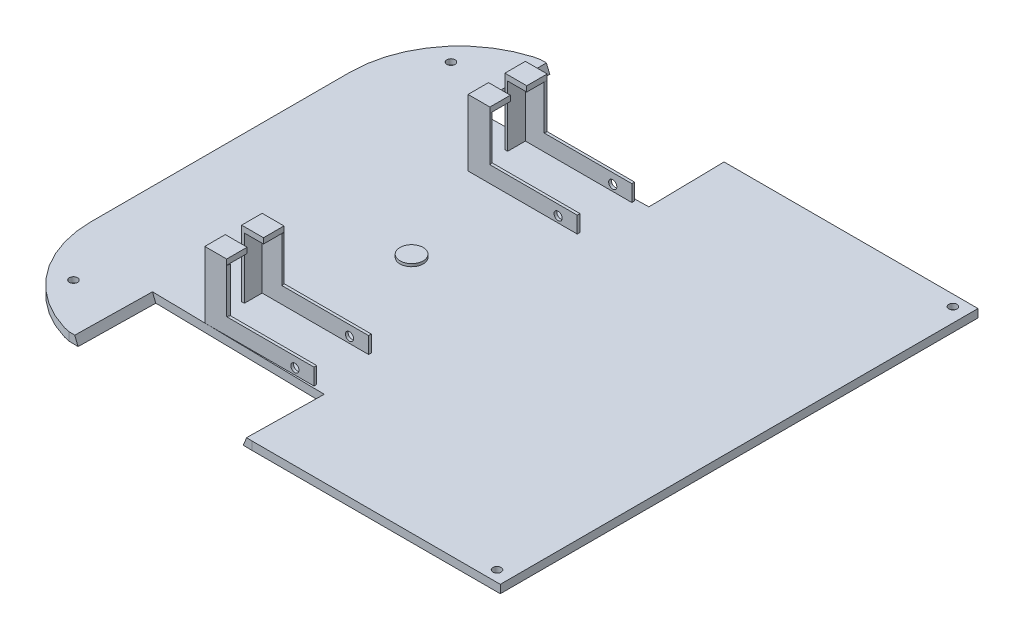
from build123d import *

# Parameters (mm, degrees)
BOSS_EXTRUDE2_DEPTH      = 3
SKETCH9_R                = 34
CUT_EXTRUDE6_DEPTH       = 28
SKETCH10_R               = 34
CUT_EXTRUDE7_DEPTH       = 28
SKETCH11_R               = 3
CUT_EXTRUDE8_DEPTH       = 1
CUT_EXTRUDE9_REACH       = 141.57
SKETCH12_R               = 1.5
SKETCH14_R               = 1.5
CUT_EXTRUDE10_DEPTH      = 5
SKETCH15_R               = 3
CUT_EXTRUDE11_DEPTH      = 1
SKETCH16_W               = 40
SKETCH16_H               = 21
BOSS_EXTRUDE3_DEPTH      = 6
SKETCH17_W               = 40
SKETCH17_H               = 4
CUT_EXTRUDE12_DEPTH      = 6
SKETCH19_W               = 39
SKETCH19_H               = 7.5
CUT_EXTRUDE13_DEPTH      = 6
CUT_EXTRUDE14_DEPTH      = 30
CUT_EXTRUDE14_DEPTH_BACK = 197.547353293
SKETCH20_R               = 1.5
BOSS_EXTRUDE4_DEPTH      = 16.3
SKETCH22_W               = 8
SKETCH22_H               = 8.5
BOSS_EXTRUDE5_DEPTH      = 2
SKETCH24_W               = 40
SKETCH24_H               = 4
CUT_EXTRUDE15_DEPTH      = 6
SKETCH25_W               = 39
SKETCH25_H               = 7.5
CUT_EXTRUDE16_DEPTH      = 6
BOSS_EXTRUDE6_DEPTH      = 16.3
SKETCH27_W               = 8
SKETCH27_H               = 8.5
BOSS_EXTRUDE7_DEPTH      = 2
SKETCH28_W               = 29.971448717
SKETCH28_H               = 6
CUT_EXTRUDE17_DEPTH      = 30
SKETCH29_R               = 4.248985817
BOSS_EXTRUDE8_DEPTH      = 1


with BuildPart() as part:
    # Sketch8 → Boss-Extrude2 (new body)
    with BuildSketch(Plane(origin=(0, -104.616966205, 0), x_dir=(-1, 0, 0), z_dir=(0, -1, 0))):
        with BuildLine():
            Line((-84.555077121, 83.581965945), (-84.555077121, -91.418031075))
            Line((-84.555077121, -91.418031075), (-24.555077121, -91.418031075))
            Line((-24.555077121, -91.418031075), (6.331140288, -91.418031075))
            Line((6.331140288, -91.418031075), (74.558700702, -90.266655899))
            add(Edge.make_bspline(
                [(74.558700702, -90.266655899), (75.258618176, -90.114398813), (75.958535651, -89.962141728), (76.695631162, -89.801797089), (76.732044503, -89.791105209), (78.514476701, -89.12629487), (80.261260256, -88.474780737), (82.043692454, -87.809970397), (82.078213539, -87.794205175), (83.74789112, -86.882492536), (85.384175177, -85.989014135), (87.053852786, -85.077301481), (87.08577886, -85.056783792), (88.608711072, -83.916725744), (90.101184688, -82.79946882), (91.62411688, -81.659410787), (91.652798017, -81.634558408), (92.997982959, -80.289375949), (94.316264202, -78.97109714), (95.661449144, -77.625914681), (95.686301502, -77.597233535), (96.826353324, -76.074300105), (97.943604129, -74.581825317), (99.08365597, -73.058891861), (99.104173606, -73.026965742), (100.015886276, -71.357285621), (100.90936471, -69.720999069), (101.821077334, -68.051319033), (101.836842581, -68.016798018), (102.501657888, -66.234370786), (103.153176889, -64.4875921), (103.817992195, -62.705164868), (103.828684113, -62.668751605), (104.233061809, -60.809846667), (104.629351977, -58.988119711), (105.033729682, -57.129214733), (105.039130599, -57.091650435), (105.174845486, -55.194121667), (105.307846075, -53.334543475), (105.443560962, -51.437014707), (105.444918111, -51.399015661), (105.444918111, -19.732346933), (105.444918111, 11.896274278), (105.444918111, 43.562943055), (105.443560962, 43.600942151), (105.307846074, 45.498473412), (105.174845485, 47.358054048), (105.039130599, 49.255585289), (105.033729674, 49.293149617), (104.629351973, 51.152052091), (104.233061826, 52.973776516), (103.828684125, 54.83267899), (103.817992199, 54.869092327), (103.153176896, 56.651524516), (102.501657891, 58.398308083), (101.836842581, 60.18074029), (101.821077302, 60.215261386), (100.909364655, 61.884938982), (100.015886262, 63.521223025), (99.104173615, 65.19090062), (99.083655972, 65.222826728), (97.943604143, 66.745760169), (96.826353345, 68.238234946), (95.686301512, 69.761168392), (95.661449145, 69.789849575), (94.316264201, 71.135034519), (92.997982954, 72.453315766), (91.652798014, 73.798500706), (91.624116845, 73.823353084), (90.101184643, 74.963406158), (88.608711085, 76.08065817), (87.085778884, 77.220711243), (87.053852786, 77.2412289), (85.384175185, 78.15294155), (83.747891136, 79.046419947), (82.078213546, 79.95813259), (82.043692454, 79.973897841), (80.261260254, 80.638710665), (78.514476697, 81.290227233), (76.732044501, 81.955040055), (76.695631156, 81.96573196), (75.958535638, 82.1260766), (75.25861817, 82.278333684), (74.558700702, 82.430590769)],
                knots=[0.099208332, 0.099208332, 0.099208332, 0.099208332, 0.101357192, 0.101357192, 0.101471335, 0.101471335, 0.107064322, 0.107064322, 0.107178465, 0.107178465, 0.112771457, 0.112771457, 0.1128856, 0.1128856, 0.118478601, 0.118478601, 0.118592744, 0.118592744, 0.124185732, 0.124185732, 0.124299875, 0.124299875, 0.129892868, 0.129892868, 0.130007011, 0.130007011, 0.13560001, 0.13560001, 0.135714152, 0.135714152, 0.141307131, 0.141307131, 0.141421274, 0.141421274, 0.147014271, 0.147014271, 0.147128413, 0.147128413, 0.152721398, 0.152721398, 0.152835541, 0.152835541, 0.247721405, 0.247721405, 0.247835547, 0.247835547, 0.25342854, 0.25342854, 0.253542682, 0.253542682, 0.259135672, 0.259135672, 0.259249814, 0.259249814, 0.264842807, 0.264842807, 0.26495695, 0.26495695, 0.270549942, 0.270549942, 0.270664085, 0.270664085, 0.276257078, 0.276257078, 0.276371221, 0.276371221, 0.281964214, 0.281964214, 0.282078357, 0.282078357, 0.28767135, 0.28767135, 0.287785492, 0.287785492, 0.293378485, 0.293378485, 0.293492627, 0.293492627, 0.299085617, 0.299085617, 0.29919976, 0.29919976, 0.30134862, 0.30134862, 0.30134862, 0.30134862], degree=3))
            Line((74.558700702, 82.430590769), (6.331140288, 83.581965945))
            Line((6.331140288, 83.581965945), (-24.555077121, 83.581965945))
            Line((-24.555077121, 83.581965945), (-84.555077121, 83.581965945))
        make_face()
    extrude(amount=BOSS_EXTRUDE2_DEPTH)

    # Sketch9 → Cut-Extrude6 (cut)
    with BuildSketch(Plane(origin=(-1.411889586, 0, -83.664980831), x_dir=(-0.99985763891323, 0, 0.016873111949526412), z_dir=(-0.016873111949526412, 0, -0.99985763891323))):
        with Locations((39.038588485, -93.116966205)):
            Circle(SKETCH9_R)
    extrude(amount=-CUT_EXTRUDE6_DEPTH, mode=Mode.SUBTRACT)

    # Sketch10 → Cut-Extrude7 (cut)
    with BuildSketch(Plane(origin=(-1.544089567, 0, 91.498815018), x_dir=(0.99985763891323, 0, 0.01687311194952622), z_dir=(-0.01687311194952622, 0, 0.99985763891323))):
        with Locations((-38.906369681, -93.116966205)):
            Circle(SKETCH10_R)
    extrude(amount=-CUT_EXTRUDE7_DEPTH, mode=Mode.SUBTRACT)

    # Sketch11 → Cut-Extrude8 (cut)
    with BuildSketch(Plane.XZ.offset(107.616966205)):
        with Locations(Location((-90.163500414, 73.064659404, 0), (0, 0, 270))):
            Circle(SKETCH11_R)
        with Locations(Location((-90.163500414, -65.228594274, 0), (0, 0, 90))):
            Circle(SKETCH11_R)
    extrude(amount=-CUT_EXTRUDE8_DEPTH, mode=Mode.SUBTRACT)

    # Sketch12 → Cut-Extrude9 (cut, up to next)
    with BuildSketch(Plane.XZ.offset(106.616966205), mode=Mode.PRIVATE) as cut_extrude9_sk1:
        with Locations(Location((-90.163500414, 73.064659404, 0), (0, 0, 270))):
            Circle(SKETCH12_R)
    cut_extrude9_tool1 = extrude(cut_extrude9_sk1.sketch, amount=-CUT_EXTRUDE9_REACH, mode=Mode.PRIVATE) & part.part
    # Sketch12 → Cut-Extrude9 (cut, up to next)
    with BuildSketch(Plane.XZ.offset(106.616966205), mode=Mode.PRIVATE) as cut_extrude9_sk2:
        with Locations(Location((-90.163500414, -65.228594274, 0), (0, 0, 90))):
            Circle(SKETCH12_R)
    cut_extrude9_tool2 = extrude(cut_extrude9_sk2.sketch, amount=-CUT_EXTRUDE9_REACH, mode=Mode.PRIVATE) & part.part
    add(cut_extrude9_tool1.solids().sort_by_distance((-90.1635, -106.616966, 73.064659))[0], mode=Mode.SUBTRACT)
    add(cut_extrude9_tool2.solids().sort_by_distance((-90.1635, -106.616966, -65.228594))[0], mode=Mode.SUBTRACT)

    # Sketch14 → Cut-Extrude10 (cut)
    with BuildSketch(Plane(origin=(0, -104.616966205, 0), x_dir=(1, 0, 0), z_dir=(0, 1, 0))):
        with Locations(Location((79.356666556, 79.581965945, 0), (0, 0, 270))):
            Circle(SKETCH14_R)
        with Locations(Location((79.356666556, -87.418031075, 0), (0, 0, 270))):
            Circle(SKETCH14_R)
    extrude(amount=-CUT_EXTRUDE10_DEPTH, mode=Mode.SUBTRACT)

    # Sketch15 → Cut-Extrude11 (cut)
    with BuildSketch(Plane.XZ.offset(107.616966205)):
        with Locations(Location((79.356666556, 87.418031075, 0), (0, 0, 270))):
            Circle(SKETCH15_R)
        with Locations(Location((79.356666556, -79.581965945, 0), (0, 0, 270))):
            Circle(SKETCH15_R)
    extrude(amount=-CUT_EXTRUDE11_DEPTH, mode=Mode.SUBTRACT)

    # Sketch16 → Boss-Extrude3 (add)
    with BuildSketch(Plane(origin=(0, -104.616966205, 0), x_dir=(1, 0, 0), z_dir=(0, 1, 0))):
        with Locations((-32.47247336, -52.135385668)):
            Rectangle(SKETCH16_W, SKETCH16_H)
        with Locations((-32.47247336, 44.299320538)):
            Rectangle(SKETCH16_W, SKETCH16_H)
    extrude(amount=BOSS_EXTRUDE3_DEPTH)

    # Sketch17 → Cut-Extrude12 (cut)
    with BuildSketch(Plane(origin=(0, -98.616966205, 0), x_dir=(1, 0, 0), z_dir=(0, 1, 0))):
        with Locations((-32.47247336, -52.135385668)):
            Rectangle(SKETCH17_W, SKETCH17_H)
    extrude(amount=-CUT_EXTRUDE12_DEPTH, mode=Mode.SUBTRACT)

    # Sketch19 → Cut-Extrude13 (cut)
    with BuildSketch(Plane(origin=(0, -98.616966205, 0), x_dir=(1, 0, 0), z_dir=(0, 1, 0))):
        with Locations((-31.97247336, -57.885385668)):
            Rectangle(SKETCH19_W, SKETCH19_H)
        with Locations((-31.97247336, -46.385385668)):
            Rectangle(SKETCH19_W, SKETCH19_H)
    extrude(amount=-CUT_EXTRUDE13_DEPTH, mode=Mode.SUBTRACT)

    # Sketch20 → Cut-Extrude14 (cut, two sides: drawn at the far end of the back side and taken through both)
    with BuildSketch(Plane.XY.offset(42.635385668).offset(-CUT_EXTRUDE14_DEPTH_BACK)):
        with Locations(Location((-19.47247336, -102.366966205, 0), (0, 0, 180))):
            Circle(SKETCH20_R)
    extrude(amount=CUT_EXTRUDE14_DEPTH + CUT_EXTRUDE14_DEPTH_BACK, mode=Mode.SUBTRACT)

    # Sketch21 → Boss-Extrude4 (add)
    with BuildSketch(Plane(origin=(0, -98.616966205, 0), x_dir=(1, 0, 0), z_dir=(0, 1, 0))):
        Polygon((-52.47247336, -50.135385668), (-51.47247336, -50.135385668), (-51.47247336, -42.635385668), (-44.142718828, -42.635385668), (-44.47247336, -41.635385668), (-52.47247336, -41.635385668), align=None)
        Polygon((-44.142718828, -61.635385668), (-51.47247336, -61.635385668), (-51.47247336, -54.135385668), (-52.47247336, -54.135385668), (-52.47247336, -62.635385668), (-44.47247336, -62.635385668), align=None)
    extrude(amount=BOSS_EXTRUDE4_DEPTH)

    # Sketch22 → Boss-Extrude5 (add)
    with BuildSketch(Plane(origin=(0, -82.316966205, 0), x_dir=(1, 0, 0), z_dir=(0, 1, 0))):
        with Locations((-48.47247336, -45.885385668)):
            Rectangle(SKETCH22_W, SKETCH22_H)
        with Locations((-48.47247336, -58.385385668)):
            Rectangle(SKETCH22_W, SKETCH22_H)
    extrude(amount=BOSS_EXTRUDE5_DEPTH)

    # Sketch24 → Cut-Extrude15 (cut)
    with BuildSketch(Plane(origin=(0, -98.616966205, 0), x_dir=(1, 0, 0), z_dir=(0, 1, 0))):
        with Locations((-32.47247336, 44.299320538)):
            Rectangle(SKETCH24_W, SKETCH24_H)
    extrude(amount=-CUT_EXTRUDE15_DEPTH, mode=Mode.SUBTRACT)

    # Sketch25 → Cut-Extrude16 (cut)
    with BuildSketch(Plane(origin=(0, -98.616966205, 0), x_dir=(1, 0, 0), z_dir=(0, 1, 0))):
        with Locations((-31.97247336, 38.549320538)):
            Rectangle(SKETCH25_W, SKETCH25_H)
        with Locations((-31.97247336, 50.049320538)):
            Rectangle(SKETCH25_W, SKETCH25_H)
    extrude(amount=-CUT_EXTRUDE16_DEPTH, mode=Mode.SUBTRACT)

    # Sketch26 → Boss-Extrude6 (add)
    with BuildSketch(Plane(origin=(0, -98.616966205, 0), x_dir=(1, 0, 0), z_dir=(0, 1, 0))):
        Polygon((-51.47247336, 34.799320538), (-51.47247336, 42.299320538), (-52.47247336, 42.299320538), (-52.47247336, 33.799320538), (-44.47247336, 33.799320538), (-44.642718828, 34.799320538), align=None)
        Polygon((-51.47247336, 46.299320538), (-51.47247336, 53.799320538), (-44.642718828, 53.799320538), (-44.47247336, 54.799320538), (-52.47247336, 54.799320538), (-52.47247336, 46.299320538), align=None)
    extrude(amount=BOSS_EXTRUDE6_DEPTH)

    # Sketch27 → Boss-Extrude7 (add)
    with BuildSketch(Plane(origin=(0, -82.316966205, 0), x_dir=(1, 0, 0), z_dir=(0, 1, 0))):
        with Locations((-48.47247336, 38.049320538)):
            Rectangle(SKETCH27_W, SKETCH27_H)
        with Locations((-48.47247336, 50.549320538)):
            Rectangle(SKETCH27_W, SKETCH27_H)
    extrude(amount=BOSS_EXTRUDE7_DEPTH)

    # Sketch28 → Cut-Extrude17 (cut)
    with BuildSketch(Plane(origin=(0, -104.616966205, 0), x_dir=(1, 0, 0), z_dir=(0, 1, 0))):
        with Locations((-40.778270532, 44.299320538)):
            Rectangle(SKETCH28_W, SKETCH28_H)
        with Locations((-40.778270532, -52.135385668)):
            Rectangle(SKETCH28_W, SKETCH28_H)
    extrude(amount=CUT_EXTRUDE17_DEPTH, mode=Mode.SUBTRACT)

    # Sketch29 → Boss-Extrude8 (add)
    with BuildSketch(Plane(origin=(0, -104.616966205, 0), x_dir=(1, 0, 0), z_dir=(0, 1, 0))):
        with Locations(Location((-35.443239553, -3.918214136, 0), (0, 0, 270))):
            Circle(SKETCH29_R)
    extrude(amount=BOSS_EXTRUDE8_DEPTH)


solid = part.part
